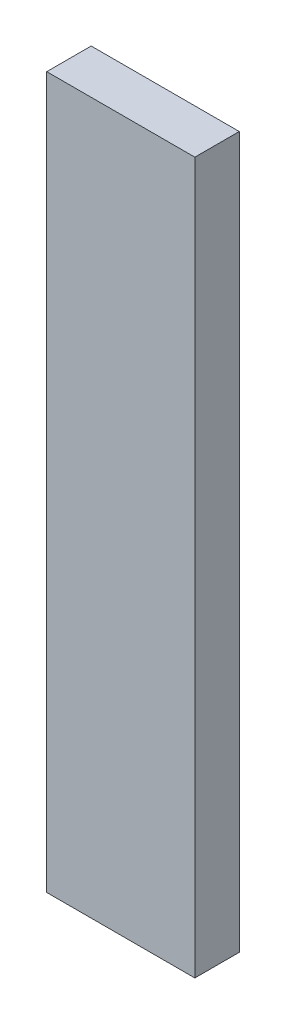
from build123d import *

# Parameters (mm, degrees)
SKETCH1_W           = 63.5
SKETCH1_H           = 19.05
BOSS_EXTRUDE1_DEPTH = 304.8


with BuildPart() as part:
    # Sketch1 → Boss-Extrude1 (new body)
    with BuildSketch(Plane(origin=(0, 0, 0), x_dir=(1, 0, 0), z_dir=(0, 1, 0))):
        with Locations((31.75, 9.525)):
            Rectangle(SKETCH1_W, SKETCH1_H)
    extrude(amount=BOSS_EXTRUDE1_DEPTH)


solid = part.part
